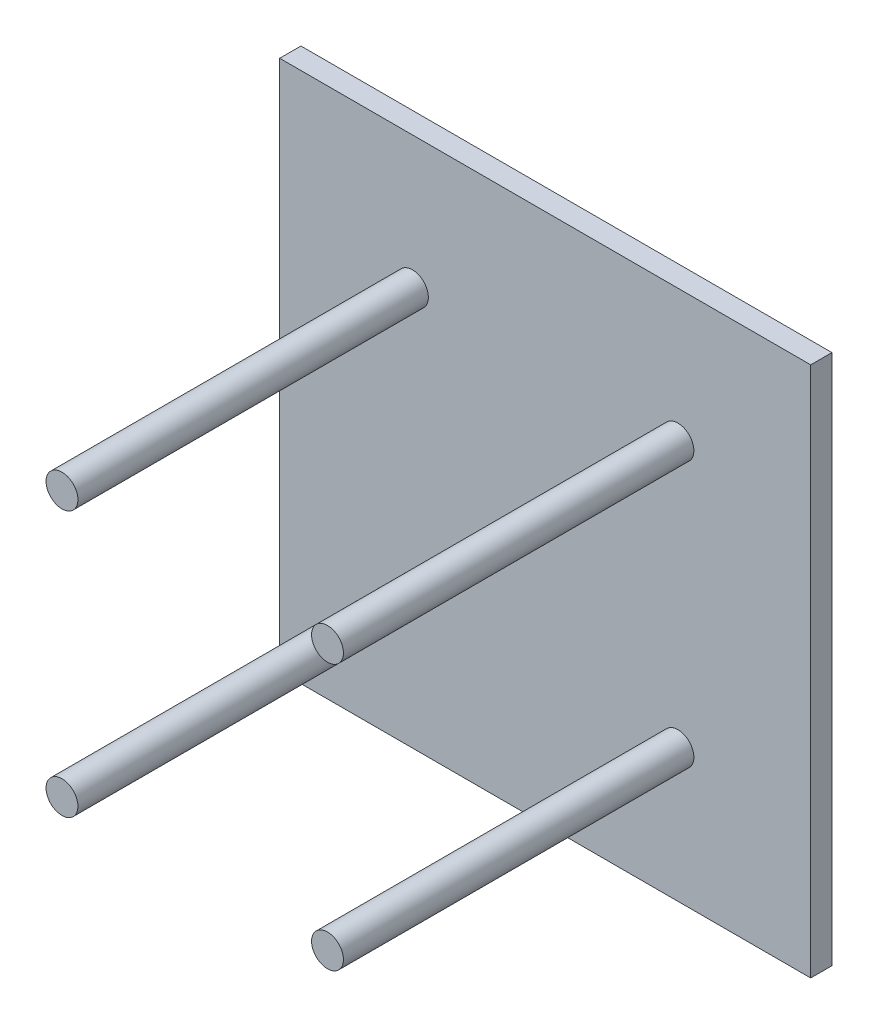
from build123d import *

# Parameters (mm, degrees)
SKETCH_1_W      = 1000
SKETCH_1_H      = 1000
EXTRUDE_1_DEPTH = 40
SKETCH_2_R      = 30
EXTRUDE_2_DEPTH = 700
SKETCH_3_R      = 30
EXTRUDE_3_DEPTH = 700
SKETCH_4_R      = 30
EXTRUDE_4_DEPTH = 700
SKETCH_5_R      = 30
EXTRUDE_5_DEPTH = 700


with BuildPart() as part:
    # 草图1 → 凸台-拉伸1 (new body)
    with BuildSketch(Plane.XY):
        Rectangle(SKETCH_1_W, SKETCH_1_H)
    extrude(amount=EXTRUDE_1_DEPTH)

    # 草图2 → 凸台-拉伸2 (add)
    with BuildSketch(Plane.XY):
        with Locations(Location((-250, -250, 0), (0, 0, 180))):
            Circle(SKETCH_2_R)
    extrude(amount=EXTRUDE_2_DEPTH)

    # 草图3 → 凸台-拉伸3 (add)
    with BuildSketch(Plane.XY):
        with Locations(Location((250, -250, 0), (0, 0, 180))):
            Circle(SKETCH_3_R)
    extrude(amount=EXTRUDE_3_DEPTH)

    # 草图4 → 凸台-拉伸4 (add)
    with BuildSketch(Plane.XY):
        with Locations(Location((-250, 250, 0), (0, 0, 180))):
            Circle(SKETCH_4_R)
    extrude(amount=EXTRUDE_4_DEPTH)

    # 草图5 → 凸台-拉伸5 (add)
    with BuildSketch(Plane.XY):
        with Locations(Location((250, 250, 0), (0, 0, 180))):
            Circle(SKETCH_5_R)
    extrude(amount=EXTRUDE_5_DEPTH)


solid = part.part
